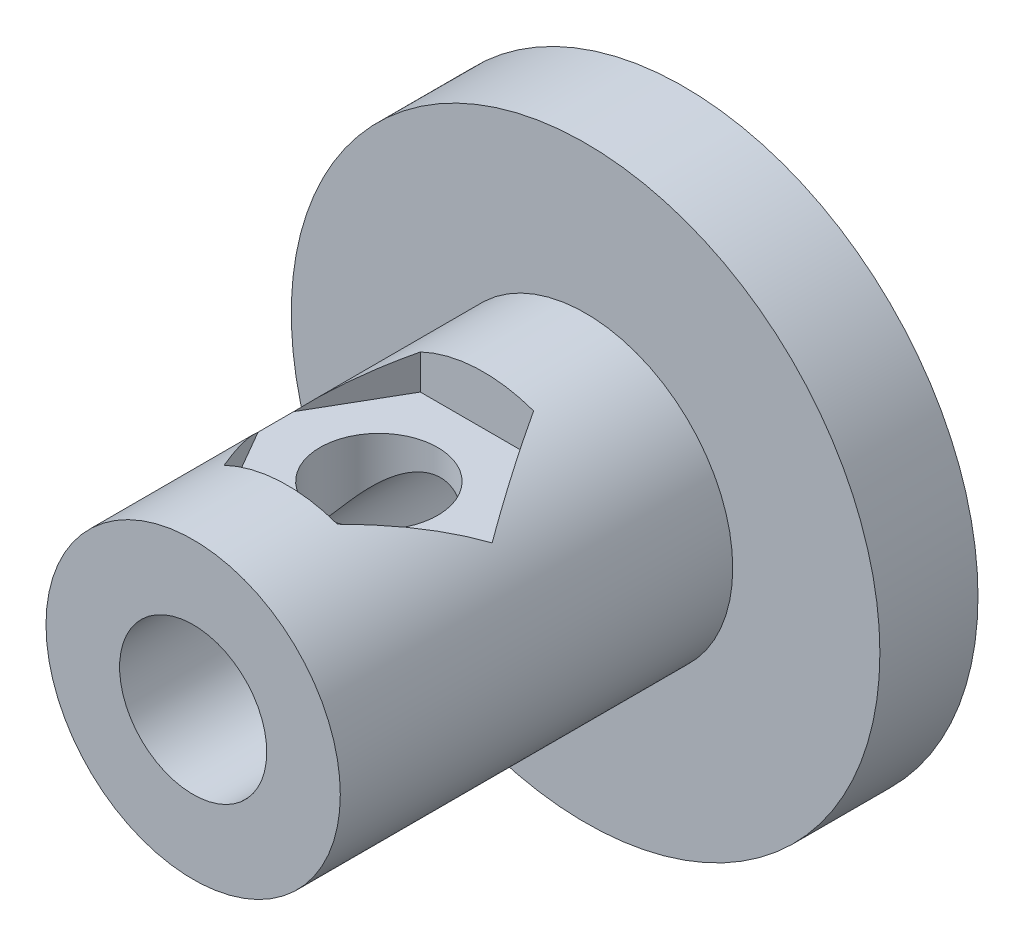
from build123d import *

# Parameters (mm, degrees)
SKETCH1_R           = 6
SKETCH1_R_2         = 1.5
BOSS_EXTRUDE1_DEPTH = 2
SKETCH2_R           = 3
SKETCH2_R_2         = 1.5
BOSS_EXTRUDE2_DEPTH = 8
CUT_EXTRUDE1_REACH  = 17.362
SKETCH3_R           = 1.2
SKETCH3_3_R         = 1.2
CUT_EXTRUDE2_DEPTH  = 2


with BuildPart() as part:
    # Sketch1 → Boss-Extrude1 (new body)
    with BuildSketch(Plane.XY):
        Circle(SKETCH1_R)
        Circle(SKETCH1_R_2, mode=Mode.SUBTRACT)
    extrude(amount=BOSS_EXTRUDE1_DEPTH)

    # Sketch2 → Boss-Extrude2 (add)
    with BuildSketch(Plane.XY.offset(2)):
        Circle(SKETCH2_R)
        Circle(SKETCH2_R_2, mode=Mode.SUBTRACT)
    extrude(amount=BOSS_EXTRUDE2_DEPTH)

    # Sketch3 → Cut-Extrude1 (cut, up to next)
    with BuildSketch(Plane(origin=(0, 4, 0), x_dir=(-1, 0, 0), z_dir=(0, 1, 0)), mode=Mode.PRIVATE) as cut_extrude1_sk1:
        with Locations((0.135733681, 6.078365877)):
            Circle(SKETCH3_R)
    cut_extrude1_tool1 = extrude(cut_extrude1_sk1.sketch, amount=-CUT_EXTRUDE1_REACH, mode=Mode.PRIVATE) & part.part
    add(cut_extrude1_tool1.solids().sort_by_distance((-0.135734, 4, 6.078366))[0], mode=Mode.SUBTRACT)

    # Sketch3<3> → Cut-Extrude2 (cut)
    with BuildSketch(Plane(origin=(0, 4, 0), x_dir=(-1, 0, 0), z_dir=(0, 1, 0))):
        Polygon((-2.173667395, 6.078365877), (-1.018966857, 4.078365877), (1.29043422, 4.078365877), (2.445134758, 6.078365877), (1.29043422, 8.078365877), (-1.018966857, 8.078365877), align=None)
        with Locations((0.135733681, 6.078365877)):
            Circle(SKETCH3_3_R, mode=Mode.SUBTRACT)
    extrude(amount=-CUT_EXTRUDE2_DEPTH, mode=Mode.SUBTRACT)


solid = part.part
